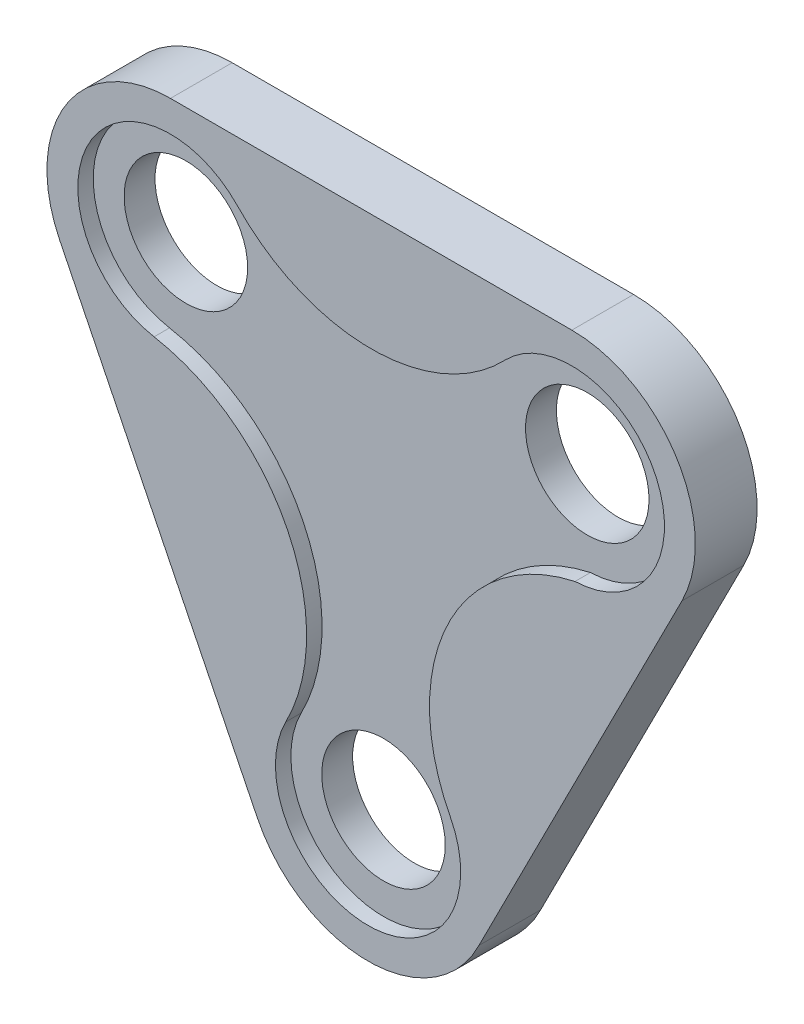
from build123d import *

# Parameters (mm, degrees)
BOSS_EXTRUDE1_DEPTH = 5
SKETCH1_3_R         = 10
BOSS_EXTRUDE2_DEPTH = 2.5


with BuildPart() as part:
    # Sketch1 → Boss-Extrude1 (new, symmetric)
    with BuildSketch(Plane.XY):
        with BuildLine():
            Line((33, 85), (-32, 85))
            ThreePointArc((-32, 85), (-48.980483062, 75.567080721), (-49.943413521, 56.166319497))
            Line((-49.943413521, 56.166319497), (-17.943413521, -8.833680503))
            ThreePointArc((-17.943413521, -8.833680503), (0, -20), (17.943413521, -8.833680503))
            Line((17.943413521, -8.833680503), (50.833146609, 55.945780983))
            ThreePointArc((50.833146609, 55.945780983), (50.045298184, 75.46220865), (33, 85))
        make_face()
        with BuildLine():
            ThreePointArc((13.317368267, 6.90273152), (0, -15), (-13.317368267, 6.90273152))
            ThreePointArc((-13.317368267, 6.90273152), (-13.036984521, 33.958715313), (-34.650701601, 50.236064853))
            ThreePointArc((-34.650701601, 50.236064853), (-45.218522192, 72.090181314), (-21.166666667, 75.374916332))
            ThreePointArc((-21.166666667, 75.374916332), (0.5, 66.124748995), (22.166666667, 75.374916332))
            ThreePointArc((22.166666667, 75.374916332), (46.692872743, 71.124151864), (33.511719921, 50.008731117))
            ThreePointArc((33.511719921, 50.008731117), (12.785531325, 33.43522428), (13.317368267, 6.90273152))
        make_face(mode=Mode.SUBTRACT)
    extrude(amount=BOSS_EXTRUDE1_DEPTH, both=True)

    # Sketch1<3> → Boss-Extrude2 (add, symmetric)
    with BuildSketch(Plane.XY):
        with BuildLine():
            ThreePointArc((-34.650701601, 50.236064853), (-13.036984521, 33.958715313), (-13.317368267, 6.90273152))
            ThreePointArc((-13.317368267, 6.90273152), (0, -15), (13.317368267, 6.90273152))
            ThreePointArc((13.317368267, 6.90273152), (12.785531325, 33.43522428), (33.511719921, 50.008731117))
            ThreePointArc((33.511719921, 50.008731117), (46.692872743, 71.124151864), (22.166666667, 75.374916332))
            ThreePointArc((22.166666667, 75.374916332), (0.5, 66.124748995), (-21.166666667, 75.374916332))
            ThreePointArc((-21.166666667, 75.374916332), (-45.218522192, 72.090181314), (-34.650701601, 50.236064853))
        make_face()
        Circle(SKETCH1_3_R, mode=Mode.SUBTRACT)
        with Locations((-32, 65)):
            Circle(SKETCH1_3_R, mode=Mode.SUBTRACT)
        with Locations((33, 65)):
            Circle(SKETCH1_3_R, mode=Mode.SUBTRACT)
    extrude(amount=BOSS_EXTRUDE2_DEPTH, both=True)


solid = part.part
